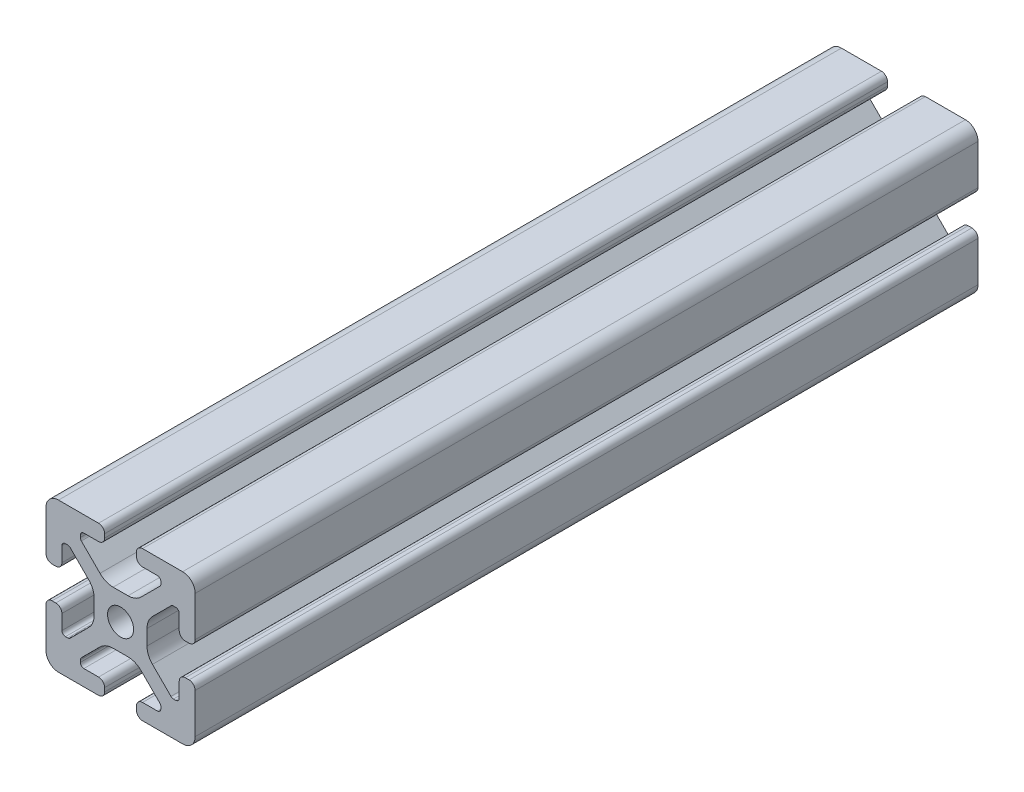
from build123d import *

# Parameters (mm, degrees)
SKETCH1_R           = 3.3274
BOSS_EXTRUDE1_DEPTH = 100


with BuildPart() as part:
    # Sketch1 → Boss-Extrude1 (new, symmetric)
    with BuildSketch(Plane.XY):
        with BuildLine():
            Line((-10.287, 13.552357131), (-10.287, 14.0843))
            ThreePointArc((-10.287, 14.0843), (-10.022898185, 14.721898185), (-9.3853, 14.986))
            Line((-9.3853, 14.986), (-5.617617549, 14.986))
            ThreePointArc((-5.617617549, 14.986), (-4.519044045, 15.441044045), (-4.064, 16.539617549))
            Line((-4.064, 16.539617549), (-4.064, 17.496382451))
            ThreePointArc((-4.064, 17.496382451), (-4.519044045, 18.594955955), (-5.617617549, 19.05))
            Line((-5.617617549, 19.05), (-7.974178704, 19.05))
            Line((-7.974178704, 19.05), (-15.847487039, 19.05))
            ThreePointArc((-15.847487039, 19.05), (-18.120176289, 18.120192083), (-19.05, 15.847509295))
            Line((-19.05, 15.847509295), (-19.05, 7.97632366))
            Line((-19.05, 7.97632366), (-19.05, 5.617617549))
            ThreePointArc((-19.05, 5.617617549), (-18.594955955, 4.519044045), (-17.496382451, 4.064))
            Line((-17.496382451, 4.064), (-16.539617549, 4.064))
            ThreePointArc((-16.539617549, 4.064), (-15.441044045, 4.519044045), (-14.986, 5.617617549))
            Line((-14.986, 5.617617549), (-14.986, 9.385342516))
            ThreePointArc((-14.986, 9.385342516), (-14.721898185, 10.022940701), (-14.0843, 10.287042516))
            Line((-14.0843, 10.287042516), (-13.516042086, 10.287042516))
            ThreePointArc((-13.516042086, 10.287042516), (-13.170975923, 10.218404478), (-12.878443117, 10.022939917))
            Line((-12.878443117, 10.022939917), (-8.14758008, 5.292065243))
            ThreePointArc((-8.14758008, 5.292065243), (-7.117955879, 3.751120653), (-6.7564, 1.933453584))
            Line((-6.7564, 1.933453584), (-6.7564, -1.933453584))
            ThreePointArc((-6.7564, -1.933453584), (-7.117955879, -3.751120653), (-8.14758008, -5.292065243))
            Line((-8.14758008, -5.292065243), (-12.878443117, -10.022939917))
            ThreePointArc((-12.878443117, -10.022939917), (-13.170975923, -10.218404478), (-13.516042086, -10.287042516))
            Line((-13.516042086, -10.287042516), (-14.0843, -10.287042516))
            ThreePointArc((-14.0843, -10.287042516), (-14.721898185, -10.022940701), (-14.986, -9.385342516))
            Line((-14.986, -9.385342516), (-14.986, -5.617617549))
            ThreePointArc((-14.986, -5.617617549), (-15.441044045, -4.519044045), (-16.539617549, -4.064))
            Line((-16.539617549, -4.064), (-17.496382451, -4.064))
            ThreePointArc((-17.496382451, -4.064), (-18.594955955, -4.519044045), (-19.05, -5.617617549))
            Line((-19.05, -5.617617549), (-19.05, -7.976318491))
            Line((-19.05, -7.976318491), (-19.05, -15.847510721))
            ThreePointArc((-19.05, -15.847510721), (-18.120175716, -18.120192644), (-15.847486868, -19.05))
            Line((-15.847486868, -19.05), (-7.976294616, -19.05))
            Line((-7.976294616, -19.05), (-5.617617549, -19.05))
            ThreePointArc((-5.617617549, -19.05), (-4.519044045, -18.594955955), (-4.064, -17.496382451))
            Line((-4.064, -17.496382451), (-4.064, -16.539617549))
            ThreePointArc((-4.064, -16.539617549), (-4.519044045, -15.441044045), (-5.617617549, -14.986))
            Line((-5.617617549, -14.986), (-9.3853, -14.986))
            ThreePointArc((-9.3853, -14.986), (-10.022898185, -14.721898185), (-10.287, -14.0843))
            Line((-10.287, -14.0843), (-10.287, -13.552357131))
            ThreePointArc((-10.287, -13.552357131), (-10.218362387, -13.207291992), (-10.022898969, -12.91475973))
            Line((-10.022898969, -12.91475973), (-5.252158105, -8.144007132))
            ThreePointArc((-5.252158105, -8.144007132), (-3.715177372, -7.117027388), (-1.902183975, -6.7564))
            Line((-1.902183975, -6.7564), (1.902183975, -6.7564))
            ThreePointArc((1.902183975, -6.7564), (3.715177372, -7.117027388), (5.252158105, -8.144007132))
            Line((5.252158105, -8.144007132), (10.022898969, -12.91475973))
            ThreePointArc((10.022898969, -12.91475973), (10.218362387, -13.207291992), (10.287, -13.552357131))
            Line((10.287, -13.552357131), (10.287, -14.0843))
            ThreePointArc((10.287, -14.0843), (10.022898185, -14.721898185), (9.3853, -14.986))
            Line((9.3853, -14.986), (5.617617549, -14.986))
            ThreePointArc((5.617617549, -14.986), (4.519044045, -15.441044045), (4.064, -16.539617549))
            Line((4.064, -16.539617549), (4.064, -17.496382451))
            ThreePointArc((4.064, -17.496382451), (4.519044045, -18.594955955), (5.617617549, -19.05))
            Line((5.617617549, -19.05), (7.976294616, -19.05))
            Line((7.976294616, -19.05), (15.847486868, -19.05))
            ThreePointArc((15.847486868, -19.05), (18.120175716, -18.120192644), (19.05, -15.847510721))
            Line((19.05, -15.847510721), (19.05, -7.976318491))
            Line((19.05, -7.976318491), (19.05, -5.617617549))
            ThreePointArc((19.05, -5.617617549), (18.594955955, -4.519044045), (17.496382451, -4.064))
            Line((17.496382451, -4.064), (16.539617549, -4.064))
            ThreePointArc((16.539617549, -4.064), (15.441044045, -4.519044045), (14.986, -5.617617549))
            Line((14.986, -5.617617549), (14.986, -9.385342516))
            ThreePointArc((14.986, -9.385342516), (14.721898185, -10.022940701), (14.0843, -10.287042516))
            Line((14.0843, -10.287042516), (13.516042086, -10.287042516))
            ThreePointArc((13.516042086, -10.287042516), (13.170975923, -10.218404478), (12.878443117, -10.022939917))
            Line((12.878443117, -10.022939917), (8.14758008, -5.292065243))
            ThreePointArc((8.14758008, -5.292065243), (7.117955879, -3.751120653), (6.7564, -1.933453584))
            Line((6.7564, -1.933453584), (6.7564, 1.933453584))
            ThreePointArc((6.7564, 1.933453584), (7.117955879, 3.751120653), (8.14758008, 5.292065243))
            Line((8.14758008, 5.292065243), (12.878443117, 10.022939917))
            ThreePointArc((12.878443117, 10.022939917), (13.170975923, 10.218404478), (13.516042086, 10.287042516))
            Line((13.516042086, 10.287042516), (14.0843, 10.287042516))
            ThreePointArc((14.0843, 10.287042516), (14.721898185, 10.022940701), (14.986, 9.385342516))
            Line((14.986, 9.385342516), (14.986, 5.617617549))
            ThreePointArc((14.986, 5.617617549), (15.441044045, 4.519044045), (16.539617549, 4.064))
            Line((16.539617549, 4.064), (17.496382451, 4.064))
            ThreePointArc((17.496382451, 4.064), (18.594955955, 4.519044045), (19.05, 5.617617549))
            Line((19.05, 5.617617549), (19.05, 9.496091471))
            Line((19.05, 9.496091471), (19.05, 15.847509295))
            ThreePointArc((19.05, 15.847509295), (18.120176289, 18.120192083), (15.847487039, 19.05))
            Line((15.847487039, 19.05), (7.974178704, 19.05))
            Line((7.974178704, 19.05), (5.617617549, 19.05))
            ThreePointArc((5.617617549, 19.05), (4.519044045, 18.594955955), (4.064, 17.496382451))
            Line((4.064, 17.496382451), (4.064, 16.539617549))
            ThreePointArc((4.064, 16.539617549), (4.519044045, 15.441044045), (5.617617549, 14.986))
            Line((5.617617549, 14.986), (9.3853, 14.986))
            ThreePointArc((9.3853, 14.986), (10.022898185, 14.721898185), (10.287, 14.0843))
            Line((10.287, 14.0843), (10.287, 13.552357131))
            ThreePointArc((10.287, 13.552357131), (10.218362387, 13.207291992), (10.022898969, 12.91475973))
            Line((10.022898969, 12.91475973), (5.252158105, 8.144007132))
            ThreePointArc((5.252158105, 8.144007132), (3.715177372, 7.117027388), (1.902183975, 6.7564))
            Line((1.902183975, 6.7564), (-1.902183975, 6.7564))
            ThreePointArc((-1.902183975, 6.7564), (-3.715177372, 7.117027388), (-5.252158105, 8.144007132))
            Line((-5.252158105, 8.144007132), (-10.022898969, 12.91475973))
            ThreePointArc((-10.022898969, 12.91475973), (-10.218362387, 13.207291992), (-10.287, 13.552357131))
        make_face()
        Circle(SKETCH1_R, mode=Mode.SUBTRACT)
    extrude(amount=BOSS_EXTRUDE1_DEPTH, both=True)


solid = part.part
